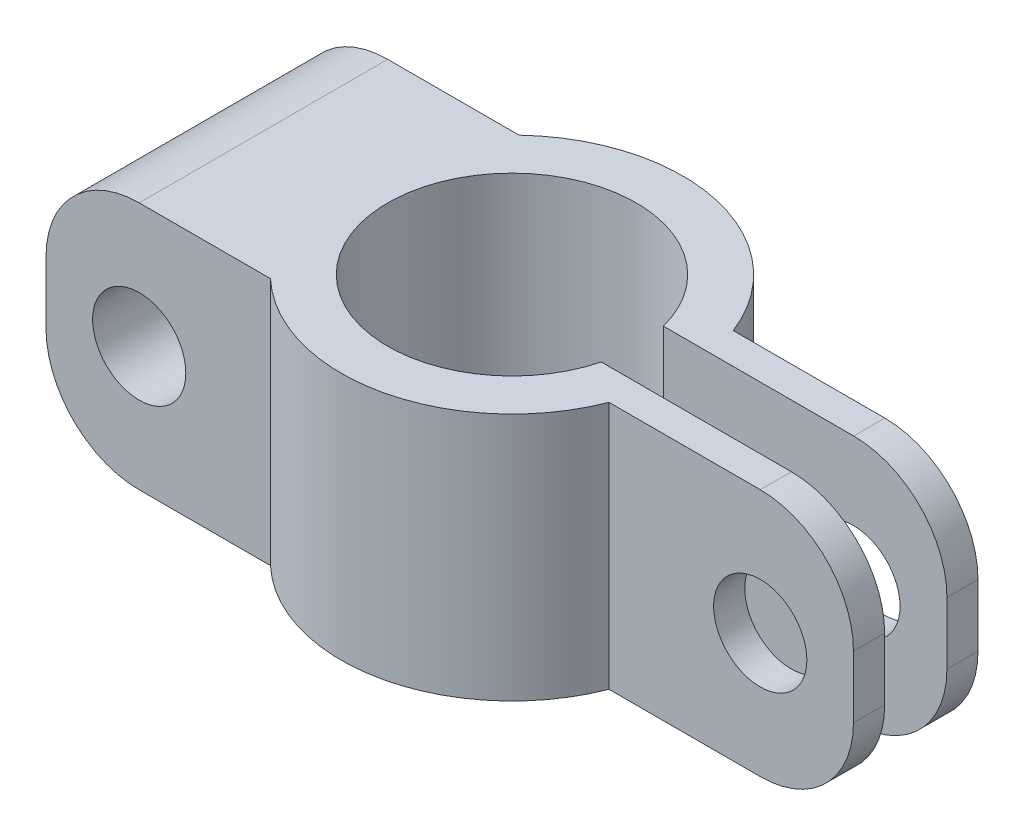
from build123d import *

# Parameters (mm, degrees)
EXTRUDE_1_DEPTH     = 8
FILLET_2_R          = 3
FILLET_3_R          = 3
FILLET_4_R          = 3
FILLET_5_R          = 3
FILLET_6_R          = 3
FILLET_7_R          = 3
SKETCH_3_R          = 1.5
CUT_EXTRUDE_1_DEPTH = 20
SKETCH_4_R          = 1.5
CUT_EXTRUDE_2_DEPTH = 20


with BuildPart() as part:
    # 草图1 → 凸台-拉伸1 (new body)
    with BuildSketch(Plane(origin=(0, 0, 0), x_dir=(1, 0, 0), z_dir=(0, 1, 0))):
        with BuildLine():
            Line((8.935144768, 1), (13, 1))
            Line((13, 1), (13, 2))
            Line((13, 2), (5.123475383, 2))
            ThreePointArc((5.123475383, 2), (1.206089666, 5.366129678), (-3.774917218, 4))
            Line((-3.774917218, 4), (-11, 4))
            Line((-11, 4), (-11, -4))
            Line((-11, -4), (-3.774917218, -4))
            ThreePointArc((-3.774917218, -4), (1.206089666, -5.366129678), (5.123475383, -2))
            Line((5.123475383, -2), (12.990817457, -2))
            Line((12.990817457, -2), (12.995479361, -1))
            Line((12.995479361, -1), (5.408326913, -1))
            Line((5.408326913, -1), (3.872983346, -1))
            ThreePointArc((3.872983346, -1), (-4, 0), (3.872983346, 1))
            Line((3.872983346, 1), (8.935144768, 1))
        make_face()
    extrude(amount=EXTRUDE_1_DEPTH)

    # 圆角2
    fillet_2_edges = [part.edges().sort_by_distance(p)[0] for p in [
        (-11, 8, 0),
    ]]
    fillet(fillet_2_edges, radius=FILLET_2_R)

    # 圆角3
    fillet_3_edges = [part.edges().sort_by_distance(p)[0] for p in [
        (-11, 0, 0),
    ]]
    fillet(fillet_3_edges, radius=FILLET_3_R)

    # 圆角4
    fillet_4_edges = [part.edges().sort_by_distance(p)[0] for p in [
        (12.993148409, 8, 1.5),
    ]]
    fillet(fillet_4_edges, radius=FILLET_4_R)

    # 圆角5
    fillet_5_edges = [part.edges().sort_by_distance(p)[0] for p in [
        (12.993148409, 0, 1.5),
    ]]
    fillet(fillet_5_edges, radius=FILLET_5_R)

    # 圆角6
    fillet_6_edges = [part.edges().sort_by_distance(p)[0] for p in [
        (13, 8, -1.5),
    ]]
    fillet(fillet_6_edges, radius=FILLET_6_R)

    # 圆角7
    fillet_7_edges = [part.edges().sort_by_distance(p)[0] for p in [
        (13, 0, -1.5),
    ]]
    fillet(fillet_7_edges, radius=FILLET_7_R)

    # 草图3 → 切除-拉伸1 (cut)
    with BuildSketch(Plane.XY.offset(4)):
        with Locations((-8, 4)):
            Circle(SKETCH_3_R)
    extrude(amount=-CUT_EXTRUDE_1_DEPTH, mode=Mode.SUBTRACT)

    # 草图4 → 切除-拉伸2 (cut)
    with BuildSketch(Plane.XY.offset(2)):
        with Locations((9.990817457, 4)):
            Circle(SKETCH_4_R)
    extrude(amount=-CUT_EXTRUDE_2_DEPTH, mode=Mode.SUBTRACT)


solid = part.part
